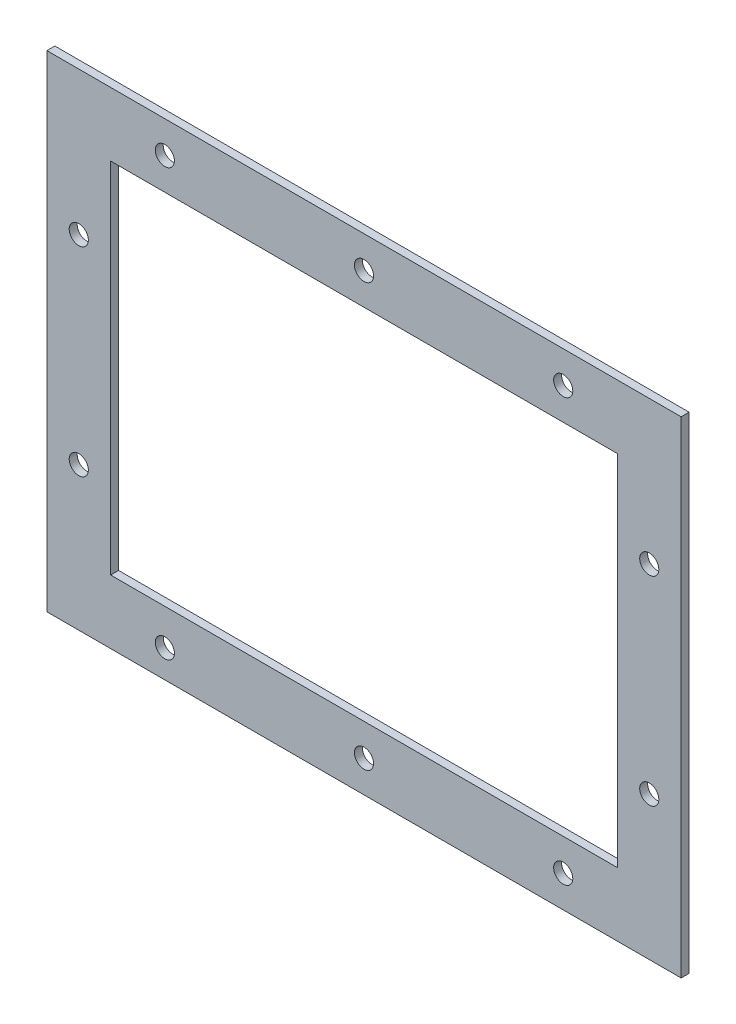
from build123d import *

# Parameters (mm, degrees)
SKETCH1_W           = 398
SKETCH1_H           = 305
SKETCH1_W_2         = 318
SKETCH1_H_2         = 225
BOSS_EXTRUDE1_DEPTH = 5
SKETCH2_R           = 6
CUT_EXTRUDE1_DEPTH  = 5


with BuildPart() as part:
    # Sketch1 → Boss-Extrude1 (new body)
    with BuildSketch(Plane.XY):
        with Locations((-34.719887955, 2)):
            Rectangle(SKETCH1_W, SKETCH1_H)
        with Locations((-34.719887955, 2)):
            Rectangle(SKETCH1_W_2, SKETCH1_H_2, mode=Mode.SUBTRACT)
    extrude(amount=BOSS_EXTRUDE1_DEPTH)

    # Sketch2 → Cut-Extrude1 (cut)
    with BuildSketch(Plane.XY.offset(5)):
        with Locations((-213.719887955, 64.5)):
            Circle(SKETCH2_R)
        with Locations((-213.719887955, -60.5)):
            Circle(SKETCH2_R)
        with Locations(Location((-159.694305461, -133.028827627, 0), (0, 0, 180))):
            Circle(SKETCH2_R)
        with Locations(Location((-34.719887955, -130.5, 0), (0, 0, 180))):
            Circle(SKETCH2_R)
        with Locations(Location((90.280112045, -130.5, 0), (0, 0, 180))):
            Circle(SKETCH2_R)
        with Locations((90.280112045, 134.5)):
            Circle(SKETCH2_R)
        with Locations((-34.719887955, 134.5)):
            Circle(SKETCH2_R)
        with Locations((-159.719887955, 134.5)):
            Circle(SKETCH2_R)
        with Locations(Location((144.280112045, -60.5, 0), (0, 0, 180))):
            Circle(SKETCH2_R)
        with Locations(Location((144.280112045, 64.5, 0), (0, 0, 180))):
            Circle(SKETCH2_R)
    extrude(amount=-CUT_EXTRUDE1_DEPTH, mode=Mode.SUBTRACT)


solid = part.part
